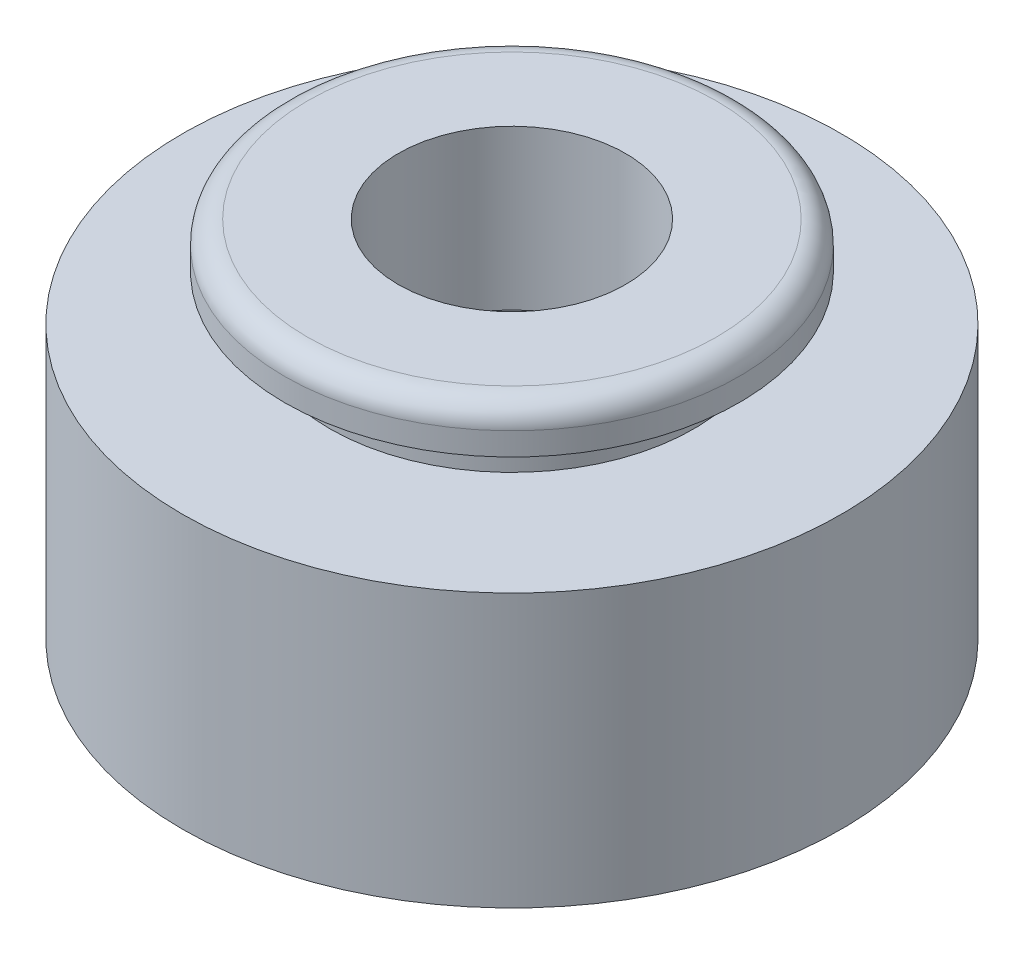
from build123d import *

# Parameters (mm, degrees)
SKETCH_1_R           = 14.5
SKETCH_1_R_2         = 7.5
EXTRUDE_1_DEPTH      = 12
EXTRUDE_2_DEPTH      = 2
EXTRUDE_2_DEPTH_BACK = 3
SKETCH_2_R           = 8
SKETCH_2_R_2         = 5
SKETCH_3_R           = 10
SKETCH_3_R_2         = 5
EXTRUDE_3_DEPTH      = 2
FILLET_1_R           = 1


with BuildPart() as part:
    # Эскиз1 → Бобышка-Вытянуть1 (new body)
    with BuildSketch(Plane(origin=(0, 0, 0), x_dir=(1, 0, 0), z_dir=(0, 1, 0))):
        with Locations(Location((0, 0, 0), (0, 0, 270))):
            Circle(SKETCH_1_R)
        with Locations(Location((0, 0, 0), (0, 0, 270))):
            Circle(SKETCH_1_R_2, mode=Mode.SUBTRACT)
    extrude(amount=EXTRUDE_1_DEPTH)

    # Эскиз2 → Бобышка-Вытянуть2 (add, two sides: drawn at the far end of the back side and taken through both)
    with BuildSketch(Plane(origin=(0, 12, 0), x_dir=(1, 0, 0), z_dir=(0, 1, 0)).offset(-EXTRUDE_2_DEPTH_BACK)):
        with Locations(Location((0, 0, 0), (0, 0, 270))):
            Circle(SKETCH_2_R)
        with Locations(Location((0, 0, 0), (0, 0, 270))):
            Circle(SKETCH_2_R_2, mode=Mode.SUBTRACT)
    extrude(amount=EXTRUDE_2_DEPTH + EXTRUDE_2_DEPTH_BACK)

    # Эскиз3 → Бобышка-Вытянуть3 (add)
    with BuildSketch(Plane(origin=(0, 14, 0), x_dir=(1, 0, 0), z_dir=(0, 1, 0))):
        with Locations(Location((0, 0, 0), (0, 0, 270))):
            Circle(SKETCH_3_R)
        with Locations(Location((0, 0, 0), (0, 0, 270))):
            Circle(SKETCH_3_R_2, mode=Mode.SUBTRACT)
    extrude(amount=EXTRUDE_3_DEPTH)

    # Скругление1
    fillet_1_edges = [part.edges().sort_by_distance(p)[0] for p in [
        (0, 16, -10),
    ]]
    fillet(fillet_1_edges, radius=FILLET_1_R)


solid = part.part
